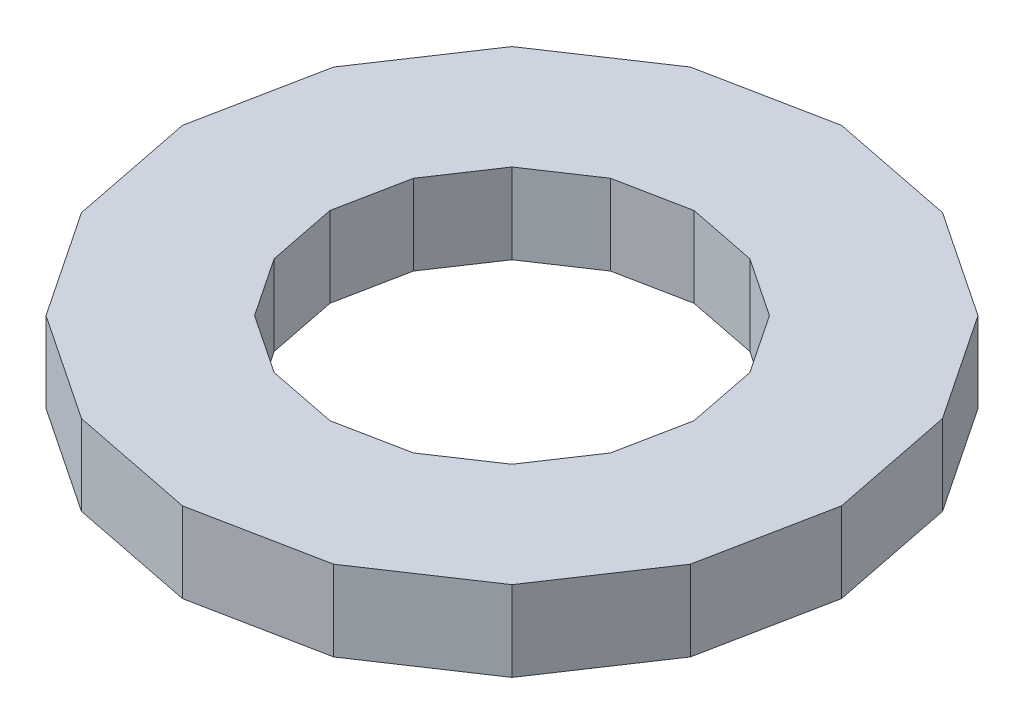
from build123d import *

# Parameters (mm, degrees)
BOSS_EXTRUDE2_DEPTH = 19.05


with BuildPart() as part:
    # Sketch2 → Boss-Extrude2 (new body)
    with BuildSketch(Plane(origin=(0, 0, 0), x_dir=(1, 0, 0), z_dir=(0, 1, 0))):
        Polygon((-78.117662847, 0), (-72.171309832, -29.894335347), (-55.23752913, -55.23752913), (-29.894335347, -72.171309832), (0, -78.117662847), (29.894335347, -72.171309832), (55.23752913, -55.23752913), (72.171309832, -29.894335347), (78.117662847, 0), (72.171309832, 29.894335347), (55.23752913, 55.23752913), (29.894335347, 72.171309832), (0, 78.117662847), (-29.894335347, 72.171309832), (-55.23752913, 55.23752913), (-72.171309832, 29.894335347), align=None)
        Polygon((-43.155882032, 0), (-39.870836117, -16.515041063), (-30.515816833, -30.515816833), (-16.515041063, -39.870836117), (0, -43.155882032), (16.515041063, -39.870836117), (30.515816833, -30.515816833), (39.870836117, -16.515041063), (43.155882032, 0), (39.870836117, 16.515041063), (30.515816833, 30.515816833), (16.515041063, 39.870836117), (0, 43.155882032), (-16.515041063, 39.870836117), (-30.515816833, 30.515816833), (-39.870836117, 16.515041063), align=None, mode=Mode.SUBTRACT)
    extrude(amount=BOSS_EXTRUDE2_DEPTH)


solid = part.part
